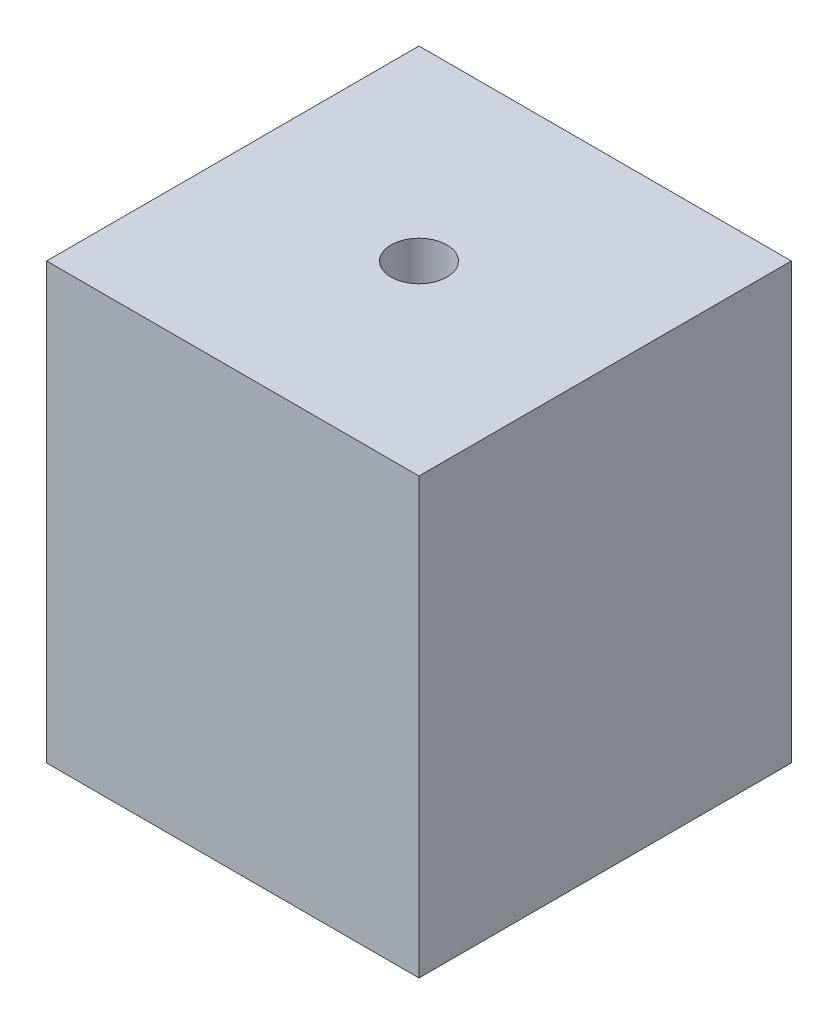
from build123d import *

# Parameters (mm, degrees)
SKETCH_1_W               = 20
SKETCH_1_H               = 20
EXTRUDE_1_DEPTH          = 23.35
CUT_EXTRUDE_1_DEPTH      = 28.298763708
CUT_EXTRUDE_1_DEPTH_BACK = 28.298763708
SKETCH_3_R               = 1.5


with BuildPart() as part:
    # 草图1 → 凸台-拉伸1 (new body)
    with BuildSketch(Plane(origin=(0, 0, 0), x_dir=(1, 0, 0), z_dir=(0, 1, 0))):
        Rectangle(SKETCH_1_W, SKETCH_1_H)
    extrude(amount=EXTRUDE_1_DEPTH)

    # 草图3 → 切除-拉伸1 (cut, two sides: drawn at the far end of the back side and taken through both)
    with BuildSketch(Plane(origin=(0, 23.35, 0), x_dir=(1, 0, 0), z_dir=(0, 1, 0)).offset(-CUT_EXTRUDE_1_DEPTH_BACK)):
        with Locations(Location((0, 0, 0), (0, 0, 270))):
            Circle(SKETCH_3_R)
    extrude(amount=CUT_EXTRUDE_1_DEPTH + CUT_EXTRUDE_1_DEPTH_BACK, mode=Mode.SUBTRACT)


solid = part.part
